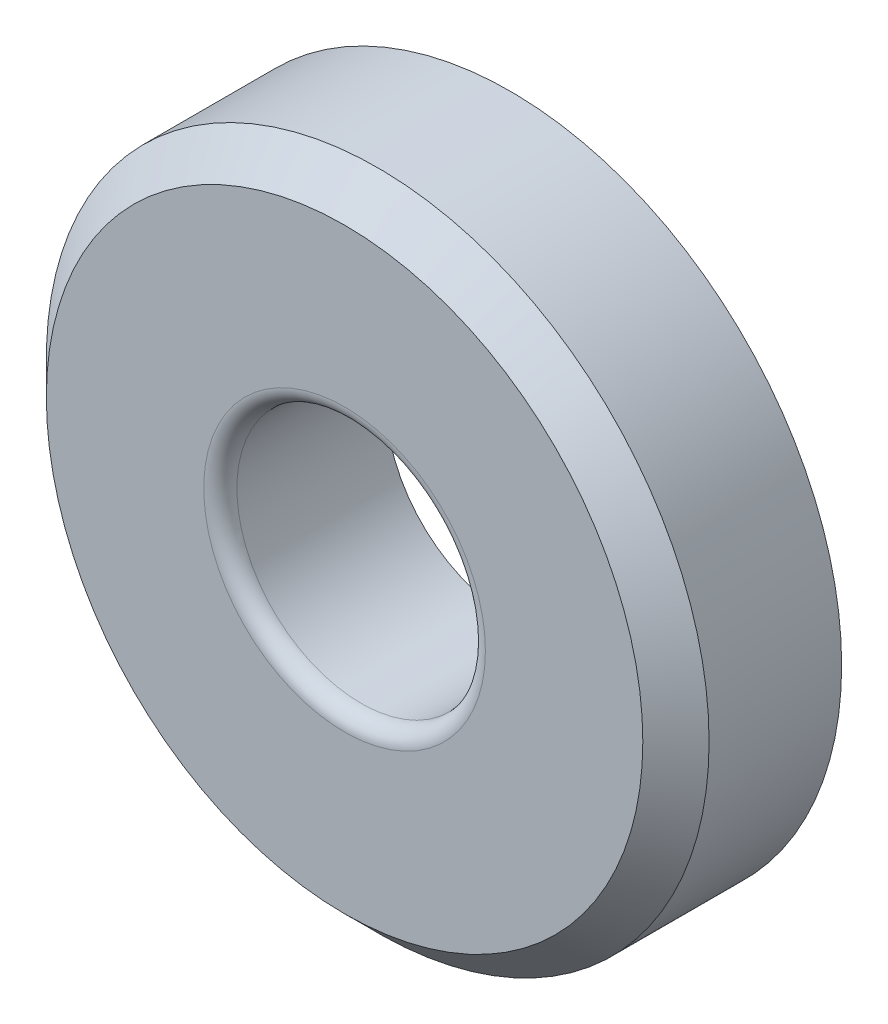
from build123d import *

# Parameters (mm, degrees)
SKETCH1_R           = 25.4
SKETCH1_R_2         = 9.525
BOSS_EXTRUDE1_DEPTH = 12.7
CHAMFER1_SIZE       = 2.54
FILLET1_R           = 1.27


with BuildPart() as part:
    # Sketch1 → Boss-Extrude1 (new body)
    with BuildSketch(Plane.XY):
        Circle(SKETCH1_R)
        Circle(SKETCH1_R_2, mode=Mode.SUBTRACT)
    extrude(amount=BOSS_EXTRUDE1_DEPTH)

    # Chamfer1
    chamfer1_edges = [part.edges().sort_by_distance(p)[0] for p in [
        (-25.4, 0, 12.7),
    ]]
    chamfer(chamfer1_edges, length=CHAMFER1_SIZE)

    # Fillet1
    fillet1_edges = [part.edges().sort_by_distance(p)[0] for p in [
        (-9.525, 0, 12.7),
    ]]
    fillet(fillet1_edges, radius=FILLET1_R)


solid = part.part
